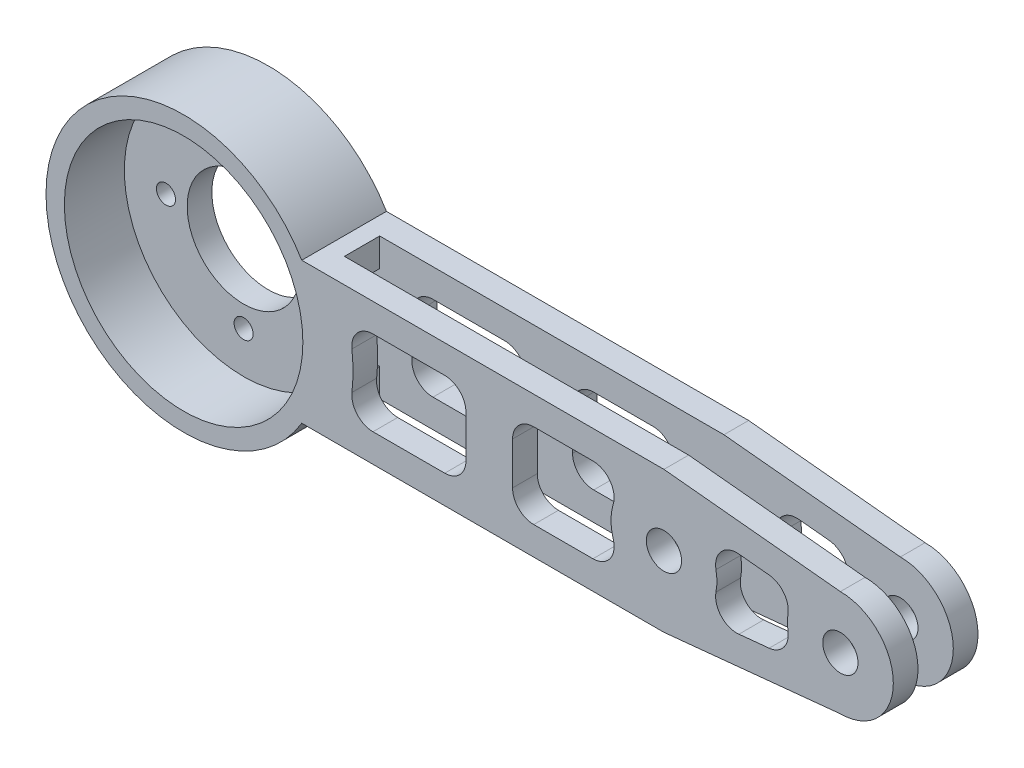
from build123d import *

# Parameters (mm, degrees)
SKETCH_2_R               = 1.35
SKETCH_2_R_2             = 2.5
EXTRUDE_1_DEPTH          = 12
SKETCH_3_W               = 81.279527938
SKETCH_3_H               = 5
CUT_EXTRUDE_1_DEPTH      = 72.933997526
SKETCH_4_R               = 16.9
CUT_EXTRUDE_2_DEPTH      = 8.5
SKETCH_5_R               = 8
CUT_EXTRUDE_3_DEPTH      = 68.917229037
CUT_EXTRUDE_4_REACH      = 86.443
CUT_EXTRUDE_4_END_RADIUS = 16.9
SKETCH_7_W               = 5
SKETCH_7_H               = 12
CUT_EXTRUDE_6_DEPTH      = 69.443407279


with BuildPart() as part:
    # 草图2 → 凸台-拉伸1 (new body)
    with BuildSketch(Plane.XY):
        with BuildLine():
            Line((-28.259330957, 10), (23.06213196, 10))
            Line((23.06213196, 10), (48.06213196, 7.5))
            ThreePointArc((48.06213196, 7.5), (55.56213196, 0), (48.06213196, -7.5))
            Line((48.06213196, -7.5), (23.06213196, -10))
            Line((23.06213196, -10), (-28.259330957, -10))
            ThreePointArc((-28.259330957, -10), (-64.5, 0), (-28.259330957, 10))
        make_face()
        with Locations((-34, 0)):
            Circle(SKETCH_2_R, mode=Mode.SUBTRACT)
        with Locations((-45, -11)):
            Circle(SKETCH_2_R, mode=Mode.SUBTRACT)
        with Locations((-56, 0)):
            Circle(SKETCH_2_R, mode=Mode.SUBTRACT)
        with Locations((-45, 11)):
            Circle(SKETCH_2_R, mode=Mode.SUBTRACT)
        with Locations((48.06213196, 0)):
            Circle(SKETCH_2_R_2, mode=Mode.SUBTRACT)
        with Locations((23.06213196, 0)):
            Circle(SKETCH_2_R_2, mode=Mode.SUBTRACT)
    extrude(amount=EXTRUDE_1_DEPTH)

    # 草图3 → 切除-拉伸1 (cut, through all)
    with BuildSketch(Plane(origin=(0, 10, 0), x_dir=(1, 0, 0), z_dir=(0, 1, 0))):
        with Locations((14.922367991, -6)):
            Rectangle(SKETCH_3_W, SKETCH_3_H)
    extrude(amount=-CUT_EXTRUDE_1_DEPTH, mode=Mode.SUBTRACT)

    # 草图4 → 切除-拉伸2 (cut)
    with BuildSketch(Plane.XY.offset(12)):
        with Locations((-45, 0)):
            Circle(SKETCH_4_R)
    extrude(amount=-CUT_EXTRUDE_2_DEPTH, mode=Mode.SUBTRACT)

    # 草图5 → 切除-拉伸3 (cut, through all)
    with BuildSketch(Plane.XY.offset(3.5)):
        with Locations((-45, 0)):
            Circle(SKETCH_5_R)
    extrude(amount=-CUT_EXTRUDE_3_DEPTH, mode=Mode.SUBTRACT)

    # 切除-拉伸4: up to this cylinder (the profile starts outside it)
    cut_extrude_4_end = Plane(origin=(-45, 0, 6), z_dir=(0, 0, 1)) * Cylinder(CUT_EXTRUDE_4_END_RADIUS, 207.686, mode=Mode.PRIVATE)
    # 草图7 → 切除-拉伸4 (cut, up to the surface)
    with BuildSketch(Plane(origin=(-25.717395978, 0, 0), x_dir=(0, 0, -1), z_dir=(1, 0, 0)), mode=Mode.PRIVATE) as cut_extrude_4_sk1:
        with Locations((-6, 0)):
            Rectangle(SKETCH_7_W, SKETCH_7_H)
    cut_extrude_4_tool1 = extrude(cut_extrude_4_sk1.sketch, amount=-CUT_EXTRUDE_4_REACH, mode=Mode.PRIVATE) - cut_extrude_4_end
    add(cut_extrude_4_tool1.solids().sort_by_distance((-25.717396, 0, 6))[0], mode=Mode.SUBTRACT)

    # 草图8 → 切除-拉伸6 (cut, through all)
    with BuildSketch(Plane.XY.offset(12)):
        with BuildLine():
            Line((-5, 3), (-5, -3))
            ThreePointArc((-5, -3), (-5.878679656, -5.121320344), (-8, -6))
            Line((-8, -6), (-18.16718427, -6))
            ThreePointArc((-18.16718427, -6), (-20.403252248, -5), (-21.14860824, -2.666666667))
            ThreePointArc((-21.14860824, -2.666666667), (-21, 0), (-21.14860824, 2.666666667))
            ThreePointArc((-21.14860824, 2.666666667), (-20.403252248, 5), (-18.16718427, 6))
            Line((-18.16718427, 6), (-8, 6))
            ThreePointArc((-8, 6), (-5.878679656, 5.121320344), (-5, 3))
        make_face()
        with BuildLine():
            Line((1.610541595, 3), (1.610541595, -3))
            ThreePointArc((1.610541595, -3), (2.489221251, -5.121320344), (4.610541595, -6))
            Line((4.610541595, -6), (12.999826061, -6))
            ThreePointArc((12.999826061, -6), (15.405177238, -4.792842914), (15.874770603, -2.142857143))
            ThreePointArc((15.874770603, -2.142857143), (15.56213196, 0), (15.874770603, 2.142857143))
            ThreePointArc((15.874770603, 2.142857143), (15.405177238, 4.792842914), (12.999826061, 6))
            Line((12.999826061, 6), (4.610541595, 6))
            ThreePointArc((4.610541595, 6), (2.489221251, 5.121320344), (1.610541595, 3))
        make_face()
        with BuildLine():
            Line((33.681175083, 4.918145439), (37.968953466, 4.489367601))
            ThreePointArc((37.968953466, 4.489367601), (40.033624407, 3.3523281), (40.639496495, 1.074468593))
            ThreePointArc((40.639496495, 1.074468593), (40.56213196, 0), (40.639496495, -1.074468593))
            ThreePointArc((40.639496495, -1.074468593), (40.033624407, -3.3523281), (37.968953466, -4.489367601))
            Line((37.968953466, -4.489367601), (33.681175083, -4.918145439))
            ThreePointArc((33.681175083, -4.918145439), (31.17263717, -3.961772821), (30.433940507, -1.380738478))
            ThreePointArc((30.433940507, -1.380738478), (30.56213196, 0), (30.433940507, 1.380738478))
            ThreePointArc((30.433940507, 1.380738478), (31.17263717, 3.961772821), (33.681175083, 4.918145439))
        make_face()
    extrude(amount=-CUT_EXTRUDE_6_DEPTH, mode=Mode.SUBTRACT)


solid = part.part
